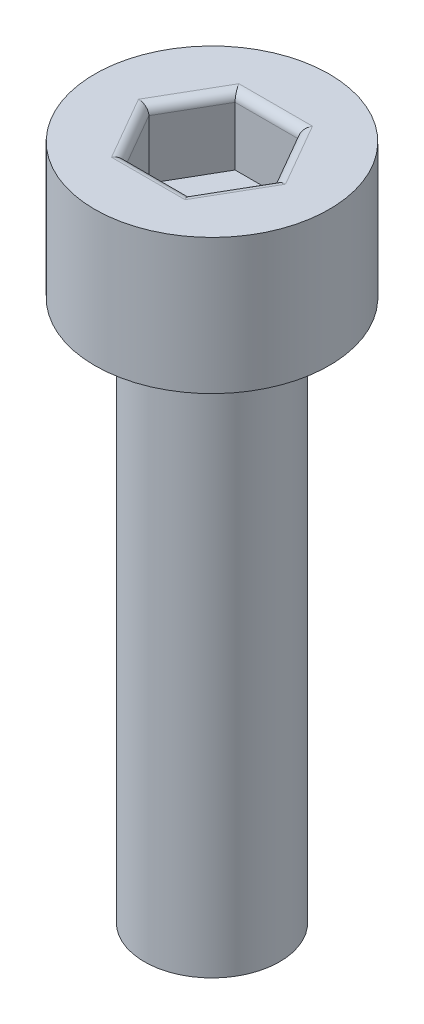
from build123d import *

# Parameters (mm, degrees)
SKETCH_1_R          = 2.6
EXTRUDE_1_DEPTH     = 3
CUT_EXTRUDE_1_DEPTH = 1.5
SKETCH_5_R          = 1.5
EXTRUDE_2_DEPTH     = 12
FILLET_1_R          = 0.2


with BuildPart() as part:
    # 草图1 → 凸台-拉伸1 (new body)
    with BuildSketch(Plane(origin=(0, 0, 0), x_dir=(1, 0, 0), z_dir=(0, 1, 0))):
        with Locations(Location((0, 0, 0), (0, 0, 270))):
            Circle(SKETCH_1_R)
    extrude(amount=EXTRUDE_1_DEPTH)

    # 草图2 → 切除-拉伸1 (cut)
    with BuildSketch(Plane(origin=(0, 3, 0), x_dir=(1, 0, 0), z_dir=(0, 1, 0))):
        Polygon((-0.7, 1.212435565), (0.7, 1.212435565), (1.4, 0), (0.7, -1.212435565), (-0.7, -1.212435565), (-1.4, 0), align=None)
    extrude(amount=-CUT_EXTRUDE_1_DEPTH, mode=Mode.SUBTRACT)

    # 草图5 → 凸台-拉伸2 (add)
    with BuildSketch(Plane.XZ):
        with Locations(Location((0, 0, 0), (0, 0, 270))):
            Circle(SKETCH_5_R)
    extrude(amount=EXTRUDE_2_DEPTH)

    # 圆角1
    fillet_1_edges = [part.edges().sort_by_distance(p)[0] for p in [
        (1.05, 3, -0.606217783),
        (1.05, 3, 0.606217783),
        (0, 3, 1.212435565),
        (-1.05, 3, 0.606217783),
        (-1.05, 3, -0.606217783),
        (0, 3, -1.212435565),
    ]]
    fillet(fillet_1_edges, radius=FILLET_1_R)


solid = part.part
